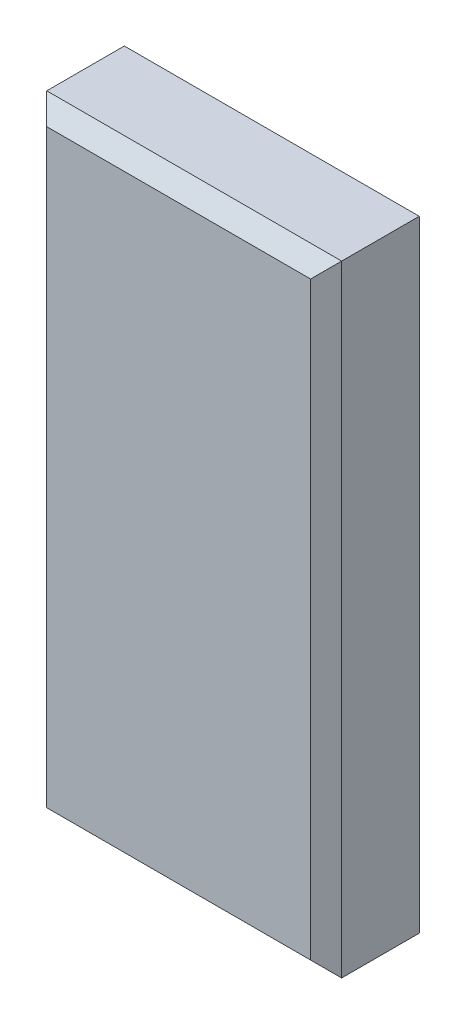
from build123d import *

# Parameters (mm, degrees)
SKETCH1_W           = 19
SKETCH1_H           = 40
BOSS_EXTRUDE1_DEPTH = 7
CHAMFER1_SIZE       = 1


with BuildPart() as part:
    # Sketch1 → Boss-Extrude1 (new body)
    with BuildSketch(Plane.XY):
        Rectangle(SKETCH1_W, SKETCH1_H)
    extrude(amount=BOSS_EXTRUDE1_DEPTH)

    # Chamfer1
    chamfer1_edges = [part.edges().sort_by_distance(p)[0] for p in [
        (-9.5, 0, 7),
        (0, -20, 7),
        (9.5, 0, 7),
        (0, -20, 0),
        (-9.5, 0, 0),
        (0, 20, 0),
        (9.5, 0, 0),
        (0, 20, 7),
    ]]
    chamfer(chamfer1_edges, length=CHAMFER1_SIZE)


solid = part.part
